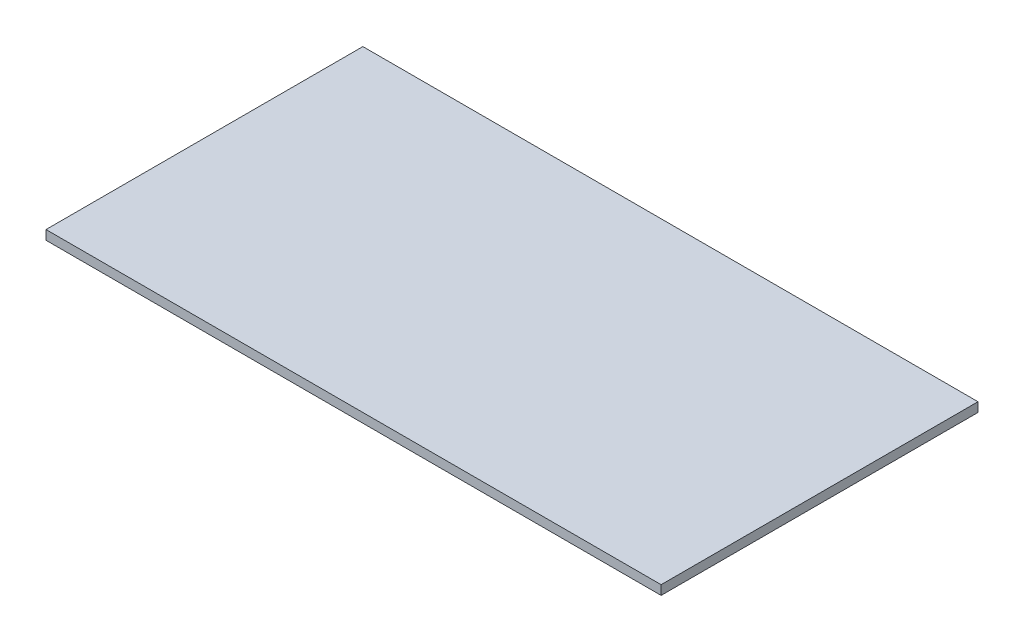
from build123d import *

# Parameters (mm, degrees)
SKETCH1_W           = 198
SKETCH1_H           = 102
BOSS_EXTRUDE1_DEPTH = 3


with BuildPart() as part:
    # Sketch1 → Boss-Extrude1 (new body)
    with BuildSketch(Plane(origin=(0, 0, 0), x_dir=(1, 0, 0), z_dir=(0, 1, 0))):
        with Locations((99, 51)):
            Rectangle(SKETCH1_W, SKETCH1_H)
    extrude(amount=BOSS_EXTRUDE1_DEPTH)


solid = part.part
